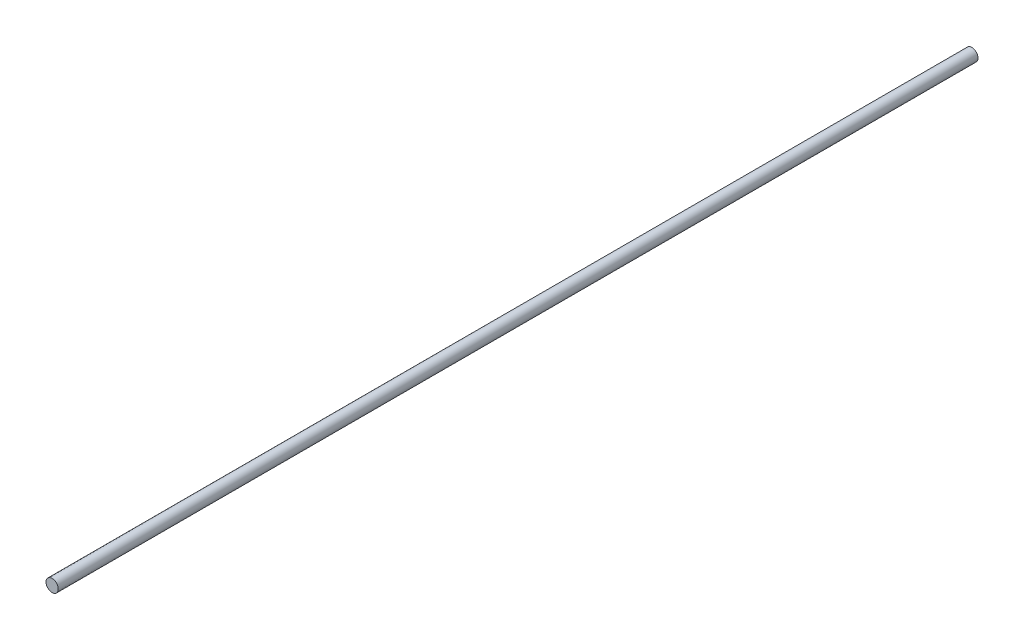
from build123d import *

# Parameters (mm, degrees)
SKETCH1_R           = 2
BOSS_EXTRUDE1_DEPTH = 300


with BuildPart() as part:
    # Sketch1 → Boss-Extrude1 (new body)
    with BuildSketch(Plane.XY):
        Circle(SKETCH1_R)
    extrude(amount=BOSS_EXTRUDE1_DEPTH)


solid = part.part
